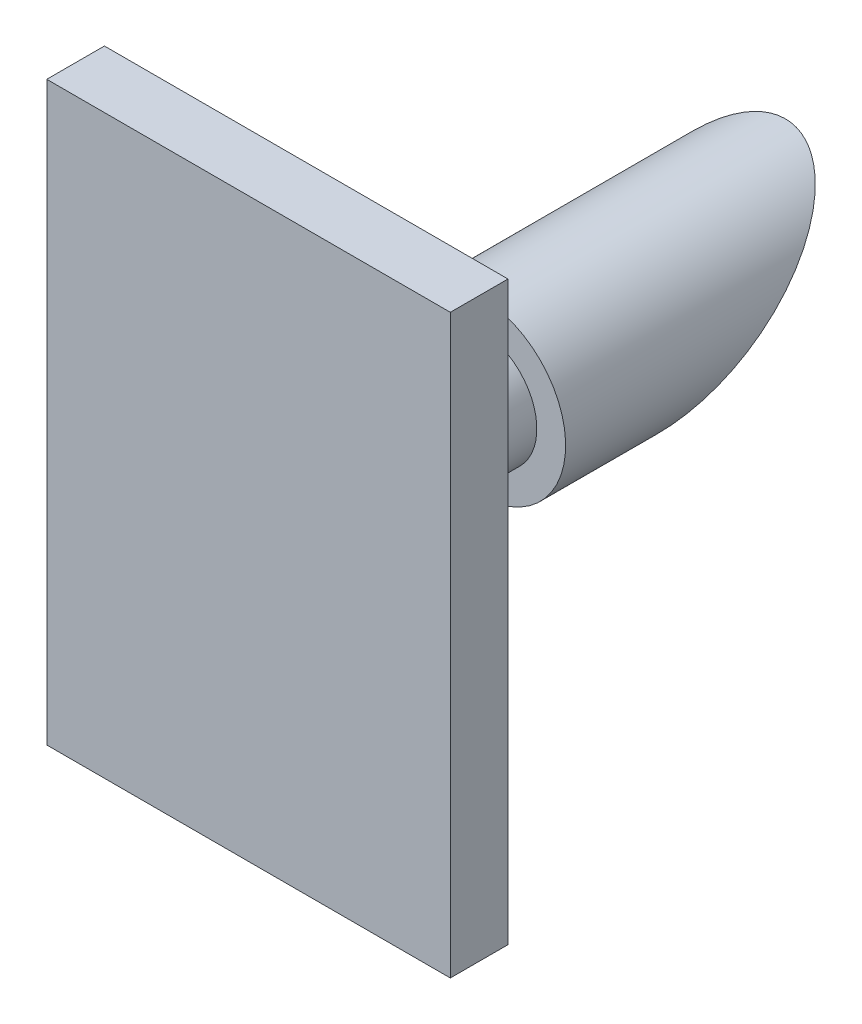
from build123d import *

# Parameters (mm, degrees)
SZKIC1_W                    = 70
SZKIC1_H                    = 100
DODANIE_WYCI_GNI_CIE1_DEPTH = 10
SZKIC2_R                    = 10
DODANIE_WYCI_GNI_CIE2_DEPTH = 30
SZKIC3_R                    = 15
DODANIE_WYCI_GNI_CIE3_DEPTH = 60
WYTNIJ_WYCI_GNI_CIE1_DEPTH  = 30


with BuildPart() as part:
    # Szkic1 → Dodanie-wyciągnięcie1 (new body)
    with BuildSketch(Plane.XY):
        Rectangle(SZKIC1_W, SZKIC1_H)
    extrude(amount=DODANIE_WYCI_GNI_CIE1_DEPTH)

    # Szkic2 → Dodanie-wyciągnięcie2 (add)
    with BuildSketch(Plane(origin=(0, 0, 0), x_dir=(-1, 0, 0), z_dir=(0, 0, -1))):
        Circle(SZKIC2_R)
    extrude(amount=DODANIE_WYCI_GNI_CIE2_DEPTH)

    # Szkic3 → Dodanie-wyciągnięcie3 (add)
    with BuildSketch(Plane(origin=(0, 0, -30), x_dir=(-1, 0, 0), z_dir=(0, 0, -1))):
        Circle(SZKIC3_R)
    extrude(amount=DODANIE_WYCI_GNI_CIE3_DEPTH)

    # Szkic4 → Wytnij-wyciągnięcie1 (cut, symmetric)
    with BuildSketch(Plane(origin=(0, 0, 0), x_dir=(0, 0, -1), z_dir=(1, 0, 0))):
        Polygon((83.125666523, 15), (44.759974282, -15), (90, -15), (90, 15), align=None)
    extrude(amount=WYTNIJ_WYCI_GNI_CIE1_DEPTH, both=True, mode=Mode.SUBTRACT)


solid = part.part
